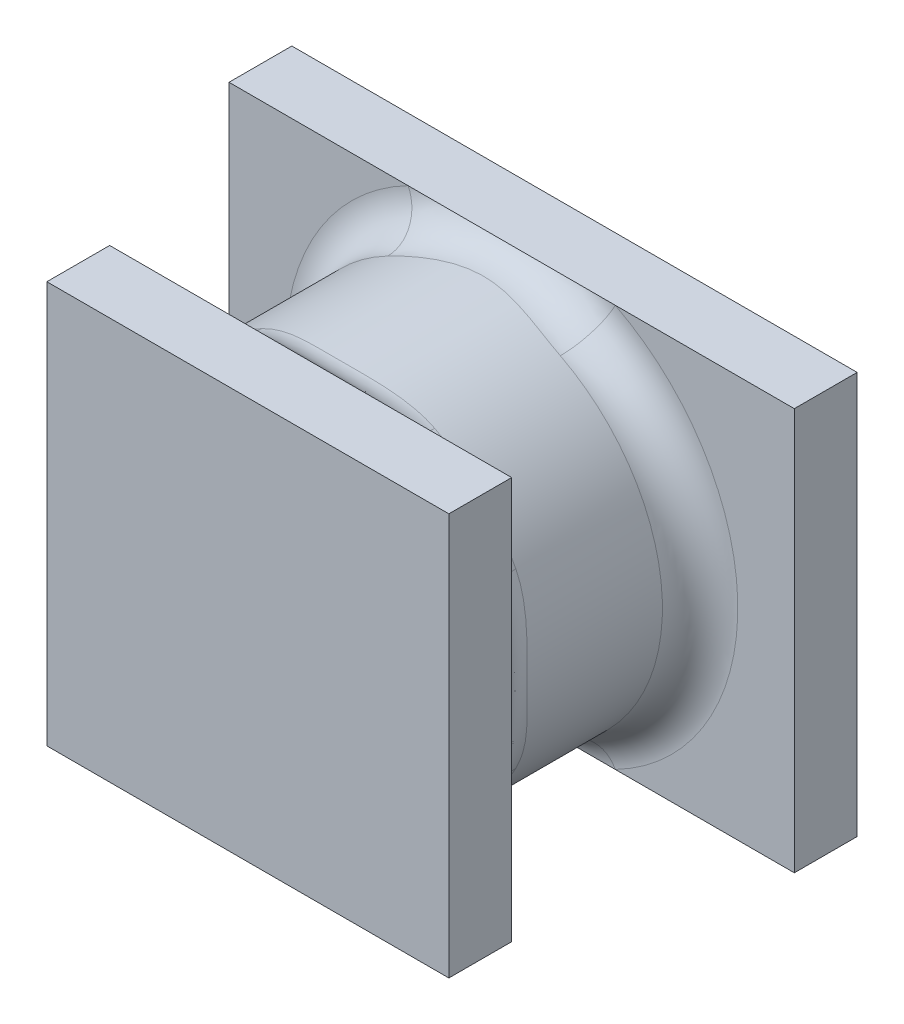
from build123d import *

# Parameters (mm, degrees)
SKETCH_1_W      = 4.5
SKETCH_1_H      = 3.2
EXTRUDE_1_DEPTH = 0.5
SKETCH_2_R      = 1.5
EXTRUDE_2_DEPTH = 1.6
SKETCH_3_W      = 3.2
SKETCH_3_H      = 3.2
EXTRUDE_3_DEPTH = 0.5
FILLET_1_R      = 0.3
FILLET_2_R      = 0.3


with BuildPart() as part:
    # Эскиз1 → Бобышка-Вытянуть1 (new body)
    with BuildSketch(Plane.XY):
        Rectangle(SKETCH_1_W, SKETCH_1_H)
    extrude(amount=EXTRUDE_1_DEPTH)

    # Эскиз2 → Бобышка-Вытянуть2 (add)
    with BuildSketch(Plane.XY.offset(0.5)):
        Circle(SKETCH_2_R)
    extrude(amount=EXTRUDE_2_DEPTH)

    # Эскиз3 → Бобышка-Вытянуть3 (add)
    with BuildSketch(Plane.XY.offset(2.1)):
        Rectangle(SKETCH_3_W, SKETCH_3_H)
    extrude(amount=EXTRUDE_3_DEPTH)

    # Скругление1
    fillet_1_edges = [part.edges().sort_by_distance(p)[0] for p in [
        (-1.5, 0, 0.5),
    ]]
    fillet(fillet_1_edges, radius=FILLET_1_R)

    # Скругление2
    fillet_2_edges = [part.edges().sort_by_distance(p)[0] for p in [
        (-1.5, 0, 2.1),
    ]]
    fillet(fillet_2_edges, radius=FILLET_2_R)


solid = part.part
